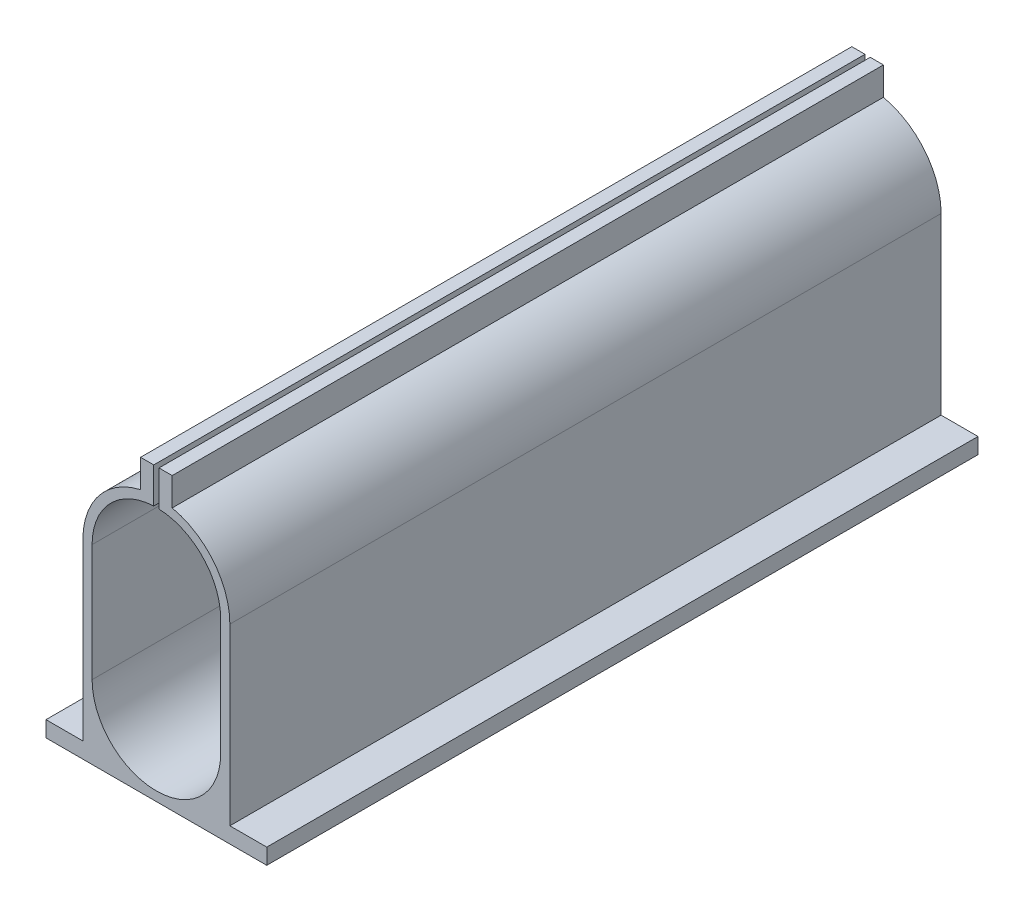
from build123d import *

# Parameters (mm, degrees)
BOSS_EXTRUDE1_DEPTH = 67.5
BOSS_EXTRUDE2_START = -3
BOSS_EXTRUDE2_DEPTH = 3
SKETCH6_W           = 6
SKETCH6_H           = 6.75
BOSS_EXTRUDE3_DEPTH = 135
SKETCH7_W           = 1
SKETCH7_H           = 40.05
CUT_EXTRUDE2_DEPTH  = 140.881753635


with BuildPart() as part:
    # Sketch2 → Boss-Extrude1 (new, symmetric)
    with BuildSketch(Plane.XY):
        with BuildLine():
            Line((-13.95, 11.1), (-13.95, -11.1))
            Line((-13.95, -11.1), (-13.95, -22.05))
            Line((-13.95, -22.05), (-20.95, -22.05))
            Line((-20.95, -22.05), (-20.95, -25.05))
            Line((-20.95, -25.05), (20.95, -25.05))
            Line((20.95, -25.05), (20.95, -22.05))
            Line((20.95, -22.05), (13.95, -22.05))
            Line((13.95, -22.05), (13.95, -11.1))
            Line((13.95, -11.1), (13.95, 11.1))
            ThreePointArc((13.95, 11.1), (0, 25.05), (-13.95, 11.1))
        make_face()
        with BuildLine():
            Line((12.2, -11.1), (12.2, 11.1))
            ThreePointArc((12.2, 11.1), (0, 23.3), (-12.2, 11.1))
            Line((-12.2, 11.1), (-12.2, -11.1))
            ThreePointArc((-12.2, -11.1), (0, -23.3), (12.2, -11.1))
        make_face(mode=Mode.SUBTRACT)
    extrude(amount=BOSS_EXTRUDE1_DEPTH, both=True)

    # Sketch5 → Boss-Extrude2 (add)
    with BuildSketch(Plane(origin=(0, 0, -67.5), x_dir=(-1, 0, 0), z_dir=(0, 0, -1)).offset(BOSS_EXTRUDE2_START)):
        with BuildLine():
            Line((-13.95, 11.1), (-13.95, -22.05))
            Line((-13.95, -22.05), (-20.95, -22.05))
            Line((-20.95, -22.05), (-20.95, -25.05))
            Line((-20.95, -25.05), (20.95, -25.05))
            Line((20.95, -25.05), (20.95, -22.05))
            Line((20.95, -22.05), (13.95, -22.05))
            Line((13.95, -22.05), (13.95, 11.1))
            ThreePointArc((13.95, 11.1), (0, 25.05), (-13.95, 11.1))
        make_face()
    extrude(amount=BOSS_EXTRUDE2_DEPTH)

    # Sketch6 → Boss-Extrude3 (add)
    with BuildSketch(Plane.XY.offset(67.5)):
        with Locations((0, 26.675)):
            Rectangle(SKETCH6_W, SKETCH6_H)
    extrude(amount=-BOSS_EXTRUDE3_DEPTH)

    # Sketch7 → Cut-Extrude2 (cut, through all)
    with BuildSketch(Plane.XY.offset(67.5)):
        with Locations((0, 10.025)):
            Rectangle(SKETCH7_W, SKETCH7_H)
    extrude(amount=-CUT_EXTRUDE2_DEPTH, mode=Mode.SUBTRACT)


solid = part.part
